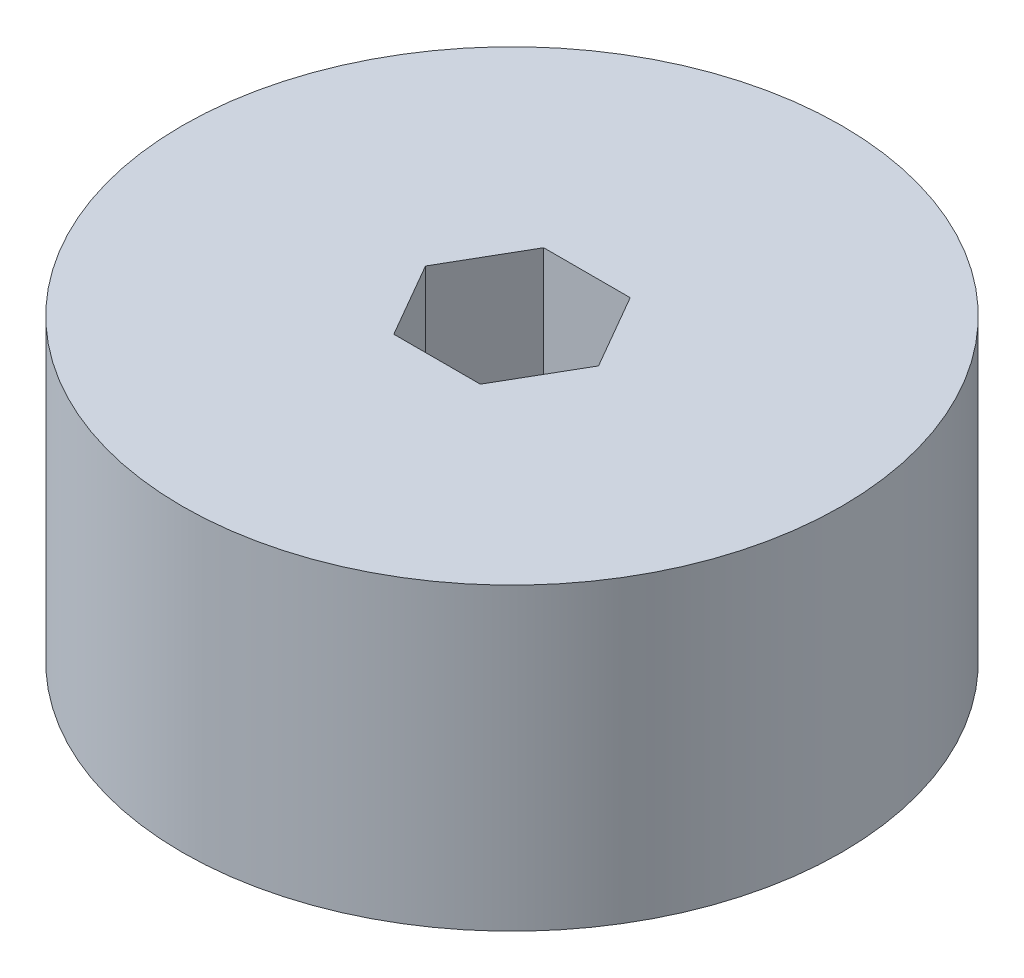
from build123d import *

# Parameters (mm, degrees)
SKETCH1_R           = 27.94
BOSS_EXTRUDE1_DEPTH = 25.4
CUT_EXTRUDE1_DEPTH  = 47.972834703


with BuildPart() as part:
    # Sketch1 → Boss-Extrude1 (new body)
    with BuildSketch(Plane(origin=(0, 0, 0), x_dir=(1, 0, 0), z_dir=(0, 1, 0))):
        with Locations(Location((0, 0, 0), (0, 0, 270))):
            Circle(SKETCH1_R)
    extrude(amount=BOSS_EXTRUDE1_DEPTH)

    # Sketch2 → Cut-Extrude1 (cut, through all)
    with BuildSketch(Plane.XZ):
        Polygon((-3.666174209, 6.35), (-7.332348419, 0), (-3.666174209, -6.35), (3.666174209, -6.35), (7.332348419, 0), (3.666174209, 6.35), align=None)
    extrude(amount=-CUT_EXTRUDE1_DEPTH, mode=Mode.SUBTRACT)


solid = part.part
